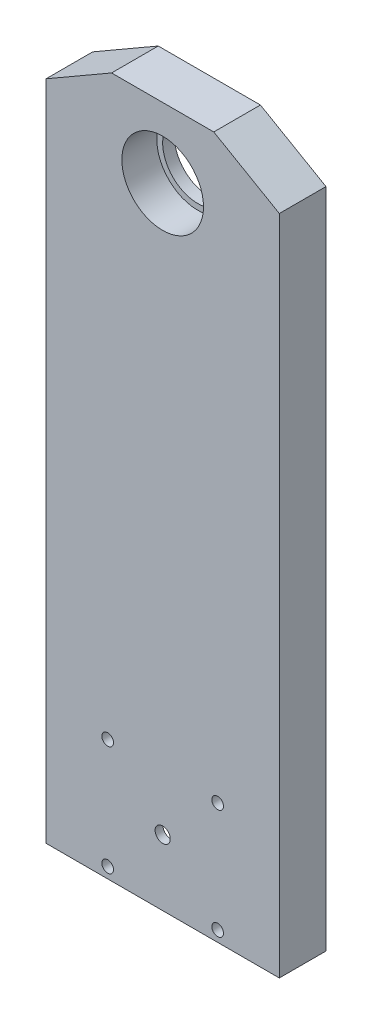
from build123d import *

# Parameters (mm, degrees)
SZKIC1_R                    = 17.5
DODANIE_WYCI_GNI_CIE1_DEPTH = 20
SZKIC1_3_R                  = 17.5
SZKIC1_3_R_2                = 15
DODANIE_WYCI_GNI_CIE2_DEPTH = 5
OTW_R_GWINTOWANY_M81_D      = 6.8
OTW_R_GWINTOWANY_M81_DEPTH  = 26.25
OTW_R_GWINTOWANY_M81_TIP    = 2.042926105
SZKIC4_R                    = 3.25
WYTNIJ_WYCI_GNI_CIE2_DEPTH  = 15
SZKIC4_4_R                  = 19.05
SZKIC4_4_R_2                = 3.25
WYTNIJ_WYCI_GNI_CIE3_DEPTH  = 16.6
SZKIC4_5_R                  = 3.25
WYTNIJ_WYCI_GNI_CIE4_DEPTH  = 49.6
SZKIC5_R                    = 2.5
WYTNIJ_WYCI_GNI_CIE5_DEPTH  = 7.6
WYTNIJ_WYCI_GNI_CIE6_DEPTH  = 10


with BuildPart() as part:
    # Szkic1 → Dodanie-wyciągnięcie1 (new body)
    with BuildSketch(Plane.XY):
        Polygon((-50, 0), (50, 0), (50, 283.776622614), (21.900286098, 300), (-21.900286098, 300), (-50, 283.776622614), align=None)
        with Locations((0, 270)):
            Circle(SZKIC1_R, mode=Mode.SUBTRACT)
    extrude(amount=DODANIE_WYCI_GNI_CIE1_DEPTH)

    # Szkic1<3> → Dodanie-wyciągnięcie2 (add)
    with BuildSketch(Plane.XY):
        with Locations((0, 270)):
            Circle(SZKIC1_3_R)
        with Locations((0, 270)):
            Circle(SZKIC1_3_R_2, mode=Mode.SUBTRACT)
    extrude(amount=DODANIE_WYCI_GNI_CIE2_DEPTH)

    # Otwór gwintowany M81
    with Locations(Plane(origin=(-35, 0, 10), x_dir=(0, 0, -1), z_dir=(0, -1, 0))):
        with Locations((0, 0), (0, 70)):
            Hole(OTW_R_GWINTOWANY_M81_D / 2, depth=OTW_R_GWINTOWANY_M81_DEPTH)
            with Locations((0, 0, -(OTW_R_GWINTOWANY_M81_DEPTH + OTW_R_GWINTOWANY_M81_TIP / 2))):  # 118° drill point
                Cone(0, OTW_R_GWINTOWANY_M81_D / 2, OTW_R_GWINTOWANY_M81_TIP, mode=Mode.SUBTRACT)

    # Szkic4 → Wytnij-wyciągnięcie2 (cut)
    with BuildSketch(Plane(origin=(0, 0, 0), x_dir=(-1, 0, 0), z_dir=(0, 0, -1))):
        with BuildLine():
            Line((-28.2, 53.4), (-28.2, 0))
            Line((-28.2, 0), (28.2, 0))
            Line((28.2, 0), (28.2, 53.4))
            ThreePointArc((28.2, 53.4), (27.321320344, 55.521320344), (25.2, 56.4))
            Line((25.2, 56.4), (-25.2, 56.4))
            ThreePointArc((-25.2, 56.4), (-27.321320344, 55.521320344), (-28.2, 53.4))
        make_face()
        with Locations((0, 28.2)):
            Circle(SZKIC4_R, mode=Mode.SUBTRACT)
    extrude(amount=-WYTNIJ_WYCI_GNI_CIE2_DEPTH, mode=Mode.SUBTRACT)

    # Szkic4<4> → Wytnij-wyciągnięcie3 (cut)
    with BuildSketch(Plane(origin=(0, 0, 0), x_dir=(-1, 0, 0), z_dir=(0, 0, -1))):
        with Locations((0, 28.2)):
            Circle(SZKIC4_4_R)
        with Locations((0, 28.2)):
            Circle(SZKIC4_4_R_2, mode=Mode.SUBTRACT)
    extrude(amount=-WYTNIJ_WYCI_GNI_CIE3_DEPTH, mode=Mode.SUBTRACT)

    # Szkic4<5> → Wytnij-wyciągnięcie4 (cut)
    with BuildSketch(Plane(origin=(0, 0, 0), x_dir=(-1, 0, 0), z_dir=(0, 0, -1))):
        with Locations((0, 28.2)):
            Circle(SZKIC4_5_R)
    extrude(amount=-WYTNIJ_WYCI_GNI_CIE4_DEPTH, mode=Mode.SUBTRACT)

    # Szkic5 → Wytnij-wyciągnięcie5 (cut)
    with BuildSketch(Plane(origin=(0, 0, 15), x_dir=(-1, 0, 0), z_dir=(0, 0, -1))):
        with Locations((-23.57, 51.77)):
            Circle(SZKIC5_R)
        with Locations((23.57, 51.77)):
            Circle(SZKIC5_R)
        with Locations((23.57, 4.63)):
            Circle(SZKIC5_R)
        with Locations((-23.57, 4.63)):
            Circle(SZKIC5_R)
    extrude(amount=-WYTNIJ_WYCI_GNI_CIE5_DEPTH, mode=Mode.SUBTRACT)

    # Szkic6 → Wytnij-wyciągnięcie6 (cut)
    with BuildSketch(Plane(origin=(0, 0, 0), x_dir=(-1, 0, 0), z_dir=(0, 0, -1))):
        with BuildLine():
            Line((-45, 228.928061115), (-45, 82.471938885))
            ThreePointArc((-45, 82.471938885), (-43.078190139, 80.039718467), (-40.267443069, 81.346910197))
            Line((-40.267443069, 81.346910197), (-5.067175687, 151.199885246))
            ThreePointArc((-5.067175687, 151.199885246), (-3.997403411, 155.7), (-5.067175687, 160.200114754))
            Line((-5.067175687, 160.200114754), (-40.267443069, 230.053089803))
            ThreePointArc((-40.267443069, 230.053089803), (-43.078190139, 231.360281533), (-45, 228.928061115))
        make_face()
        with BuildLine():
            Line((2.232556931, 145.714200914), (38.342819518, 74.055390936))
            ThreePointArc((38.342819518, 74.055390936), (38.218169264, 71.13215965), (35.663751201, 69.70535651))
            Line((35.663751201, 69.70535651), (-35.663751201, 69.70535651))
            ThreePointArc((-35.663751201, 69.70535651), (-38.218169264, 71.13215965), (-38.342819518, 74.055390936))
            Line((-38.342819518, 74.055390936), (-2.232556931, 145.714200914))
            ThreePointArc((-2.232556931, 145.714200914), (0, 147.089172226), (2.232556931, 145.714200914))
        make_face()
        with BuildLine():
            Line((45, 228.928061115), (45, 82.471938885))
            ThreePointArc((45, 82.471938885), (43.078190139, 80.039718467), (40.267443069, 81.346910197))
            Line((40.267443069, 81.346910197), (5.067175687, 151.199885246))
            ThreePointArc((5.067175687, 151.199885246), (3.997403411, 155.7), (5.067175687, 160.200114754))
            Line((5.067175687, 160.200114754), (40.267443069, 230.053089803))
            ThreePointArc((40.267443069, 230.053089803), (43.078190139, 231.360281533), (45, 228.928061115))
        make_face()
        with BuildLine():
            Line((-40.008452698, 240.649965574), (-2.232556931, 165.685799086))
            ThreePointArc((-2.232556931, 165.685799086), (0, 164.310827774), (2.232556931, 165.685799086))
            Line((2.232556931, 165.685799086), (40.008452698, 240.649965574))
            ThreePointArc((40.008452698, 240.649965574), (39.883802443, 243.57319686), (37.329384381, 245))
            Line((37.329384381, 245), (-37.32938438, 245))
            ThreePointArc((-37.32938438, 245), (-39.883802443, 243.57319686), (-40.008452698, 240.649965574))
        make_face()
    extrude(amount=-WYTNIJ_WYCI_GNI_CIE6_DEPTH, mode=Mode.SUBTRACT)


solid = part.part
